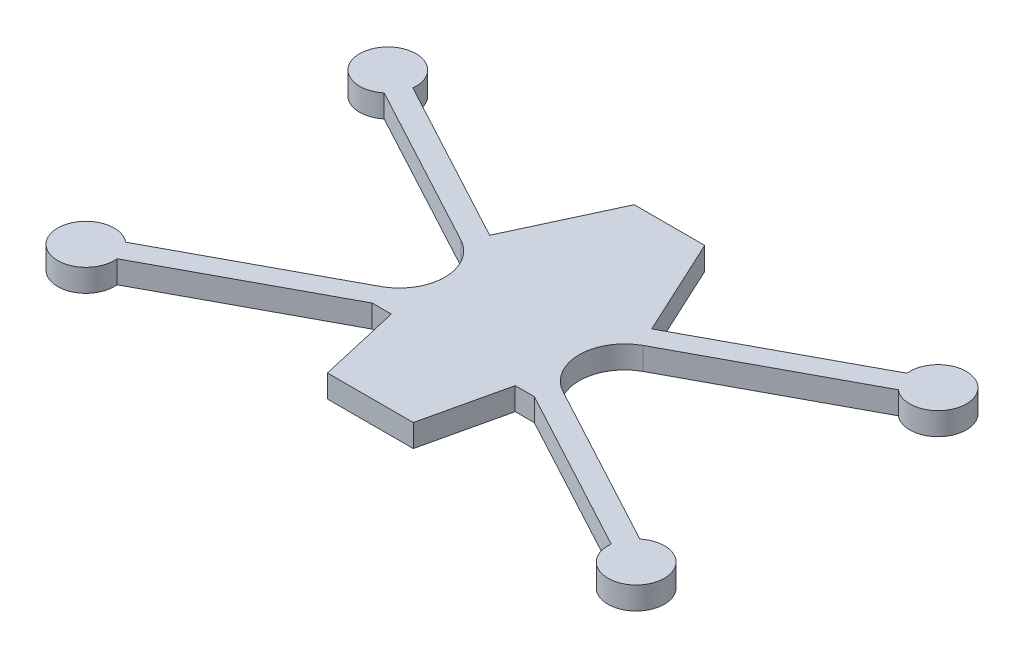
from build123d import *

# Parameters (mm, degrees)
BOSS_EXTRUDE1_DEPTH = 20.32


with BuildPart() as part:
    # Sketch1 → Boss-Extrude1 (new body)
    with BuildSketch(Plane(origin=(0, 0, 0), x_dir=(1, 0, 0), z_dir=(0, 1, 0))):
        with BuildLine():
            Line((-72.961668905, 52.840505094), (-222.399785176, 133.135612345))
            ThreePointArc((-222.399785176, 133.135612345), (-270.024680251, 147.912216254), (-231.416447367, 116.354602156))
            Line((-231.416447367, 116.354602156), (-81.978331095, 36.059494906))
            ThreePointArc((-81.978331095, 36.059494906), (-60.41841965, 0), (-81.978331095, -36.059494906))
            Line((-81.978331095, -36.059494906), (-231.416447367, -116.354602156))
            ThreePointArc((-231.416447367, -116.354602156), (-270.024680251, -147.912216254), (-222.399785176, -133.135612345))
            Line((-222.399785176, -133.135612345), (-72.961668905, -52.840505094))
            Line((-72.961668905, -52.840505094), (-55.765211733, -52.840505094))
            Line((-55.765211733, -52.840505094), (-38.625312425, -127.499494906))
            Line((-38.625312425, -127.499494906), (0, -127.499494906))
            Line((0, -127.499494906), (38.625312425, -127.499494906))
            Line((38.625312425, -127.499494906), (55.765211733, -52.840505094))
            Line((55.765211733, -52.840505094), (72.961668905, -52.840505094))
            Line((72.961668905, -52.840505094), (222.399785176, -133.135612345))
            ThreePointArc((222.399785176, -133.135612345), (270.024680251, -147.912216254), (231.416447367, -116.354602156))
            Line((231.416447367, -116.354602156), (81.978331095, -36.059494906))
            ThreePointArc((81.978331095, -36.059494906), (60.41841965, 0), (81.978331095, 36.059494906))
            Line((81.978331095, 36.059494906), (231.416447367, 116.354602156))
            ThreePointArc((231.416447367, 116.354602156), (270.024680251, 147.912216254), (222.399785176, 133.135612345))
            Line((222.399785176, 133.135612345), (72.961668905, 52.840505094))
            Line((72.961668905, 52.840505094), (31.75, 141.740505094))
            Line((31.75, 141.740505094), (-31.75, 141.740505094))
            Line((-31.75, 141.740505094), (-72.961668905, 52.840505094))
        make_face()
    extrude(amount=BOSS_EXTRUDE1_DEPTH)


solid = part.part
